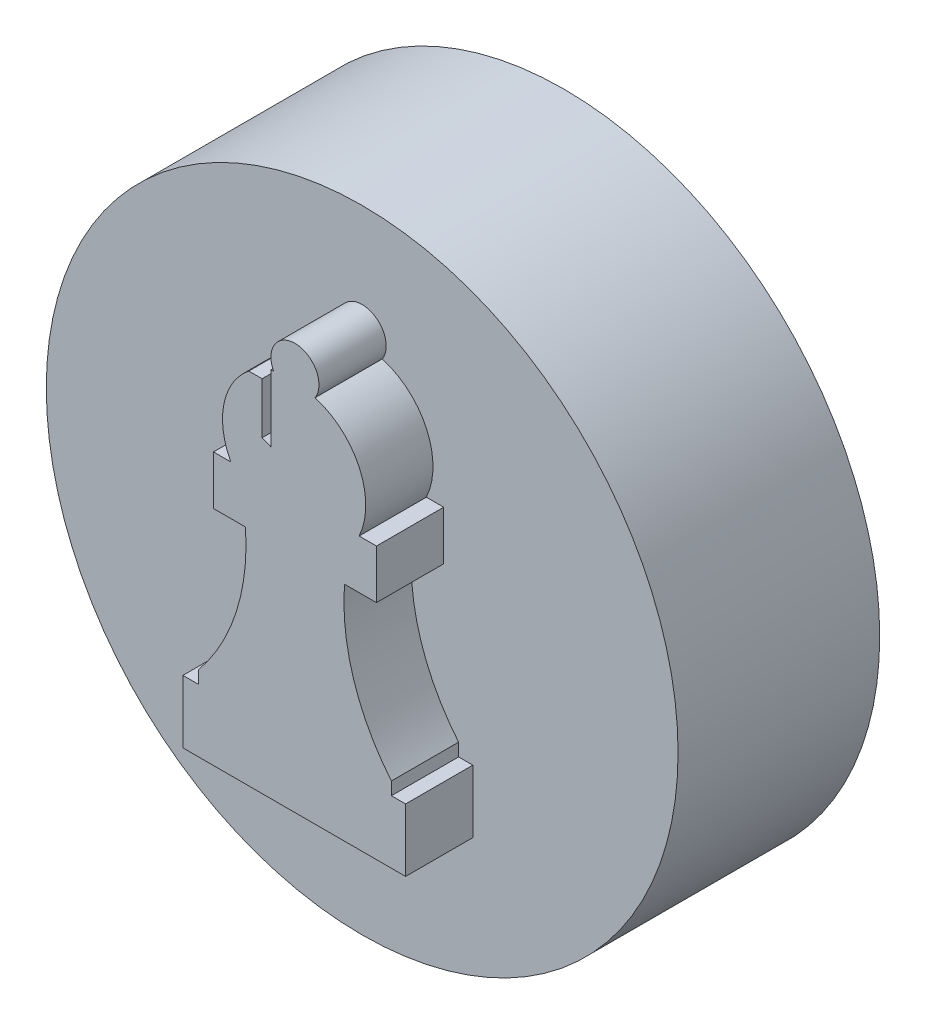
from build123d import *

# Parameters (mm, degrees)
SKETCH1_R           = 11.938
SKETCH1_R_2         = 8.763
BOSS_EXTRUDE1_DEPTH = 5.08
SKETCH2_R           = 11.938
BOSS_EXTRUDE2_DEPTH = 2.54
BOSS_EXTRUDE4_DEPTH = 2.54


with BuildPart() as part:
    # Sketch1 → Boss-Extrude1 (new body)
    with BuildSketch(Plane.XY):
        Circle(SKETCH1_R)
        Circle(SKETCH1_R_2, mode=Mode.SUBTRACT)
    extrude(amount=BOSS_EXTRUDE1_DEPTH)

    # Sketch2 → Boss-Extrude2 (add)
    with BuildSketch(Plane.XY.offset(5.08)):
        Circle(SKETCH2_R)
    extrude(amount=BOSS_EXTRUDE2_DEPTH)

    # Sketch3 → Boss-Extrude4 (add)
    with BuildSketch(Plane.XY.offset(7.62)):
        with BuildLine():
            Line((-3.643894956, -4.288673329), (-3.643894956, -3.805293576))
            ThreePointArc((-3.643894956, -3.805293576), (-2.21771863, -1.200372389), (-1.871410538, 1.749146896))
            Line((-1.871410538, 1.749146896), (-3.079634877, 1.749146896))
            Line((-3.079634877, 1.749146896), (-3.079634877, 3.601746254))
            Line((-3.079634877, 3.601746254), (-2.425208939, 3.601746254))
            ThreePointArc((-2.425208939, 3.601746254), (-2.683961488, 5.381731454), (-1.744311698, 6.915471479))
            Line((-1.744311698, 6.915471479), (-1.242224022, 6.915471479))
            Line((-1.242224022, 6.915471479), (-1.242224022, 4.985805442))
            Line((-1.242224022, 4.985805442), (-0.906720977, 4.849479664))
            Line((-0.906720977, 4.849479664), (-0.906720977, 7.372630859))
            Line((-0.906720977, 7.372630859), (-0.805595188, 7.372630859))
            ThreePointArc((-0.805595188, 7.372630859), (0.04512934, 8.694352218), (0.760232512, 7.294599731))
            ThreePointArc((0.760232512, 7.294599731), (2.43882488, 5.829651294), (2.425208939, 3.601746254))
            Line((2.425208939, 3.601746254), (3.079634877, 3.601746254))
            Line((3.079634877, 3.601746254), (3.079634877, 1.749146896))
            Line((3.079634877, 1.749146896), (1.871410538, 1.749146896))
            ThreePointArc((1.871410538, 1.749146896), (2.21771863, -1.200372389), (3.643894956, -3.805293576))
            Line((3.643894956, -3.805293576), (3.643894956, -4.288673329))
            Line((3.643894956, -4.288673329), (4.180733459, -4.288673329))
            Line((4.180733459, -4.288673329), (4.180733459, -6.661736262))
            Line((4.180733459, -6.661736262), (-4.235077354, -6.661736262))
            Line((-4.235077354, -6.661736262), (-4.235077354, -4.288673329))
            Line((-4.235077354, -4.288673329), (-3.643894956, -4.288673329))
        make_face()
    extrude(amount=BOSS_EXTRUDE4_DEPTH)


solid = part.part
